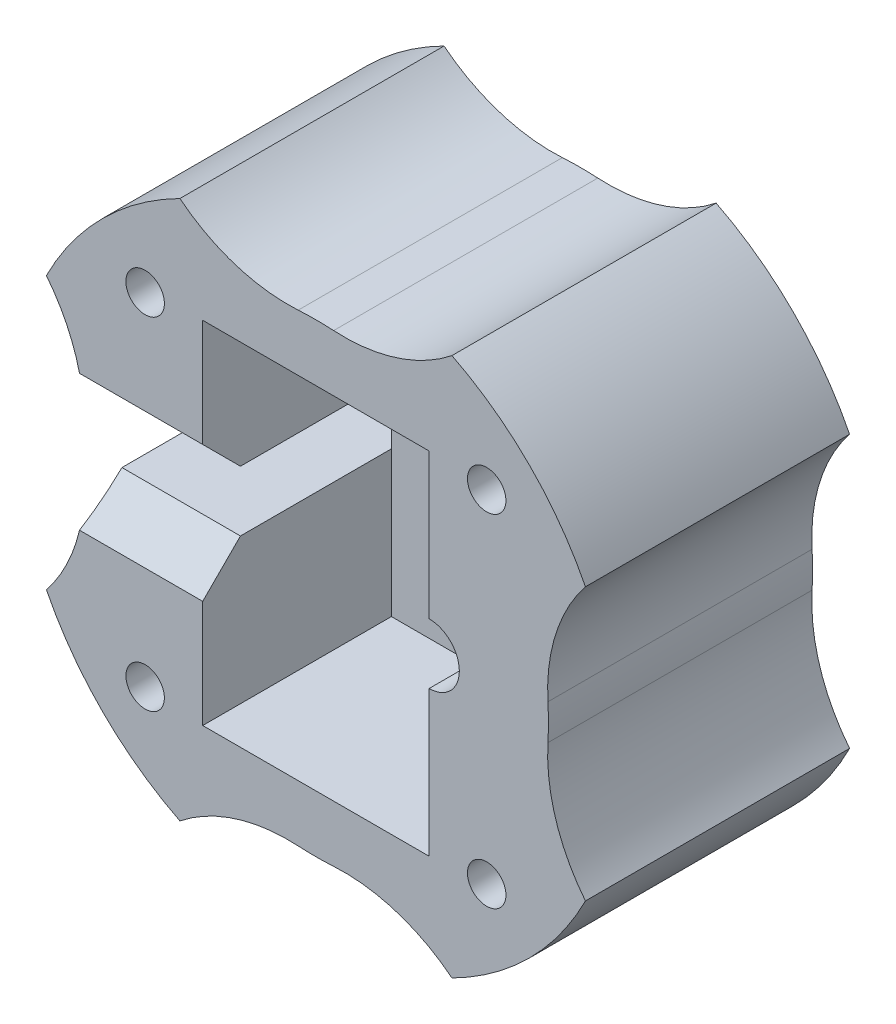
from build123d import *

# Parameters (mm, degrees)
SKETCH1_R           = 40
BOSS_EXTRUDE1_DEPTH = 10
SKETCH3_R           = 40
SKETCH3_W           = 30
SKETCH3_H           = 46.499999994
BOSS_EXTRUDE3_DEPTH = 25
CUT_EXTRUDE1_START  = -35
CUT_EXTRUDE1_DEPTH  = 35
SKETCH5_R           = 2.55
CUT_EXTRUDE2_DEPTH  = 5
CUT_EXTRUDE3_DEPTH  = 25
CUT_EXTRUDE4_DEPTH  = 22
SKETCH9_R           = 1
CUT_EXTRUDE5_DEPTH  = 10
SKETCH10_R          = 1.299999998
SKETCH10_R_2        = 1.299999999
SKETCH10_R_3        = 1.3
CUT_EXTRUDE6_DEPTH  = 10
CHAMFER1_SIZE       = 5


with BuildPart() as part:
    # Sketch1 → Boss-Extrude1 (new body)
    with BuildSketch(Plane.XY):
        with Locations((0, 222.499999997)):
            Circle(SKETCH1_R)
    extrude(amount=BOSS_EXTRUDE1_DEPTH)

    # Sketch3 → Boss-Extrude3 (add)
    with BuildSketch(Plane.XY.offset(10)):
        with Locations((0, 222.499999997)):
            Circle(SKETCH3_R)
        with Locations((0, 222.499999997)):
            Rectangle(SKETCH3_W, SKETCH3_H, mode=Mode.SUBTRACT)
    extrude(amount=BOSS_EXTRUDE3_DEPTH)

    # Sketch4 → Cut-Extrude1 (cut)
    with BuildSketch(Plane.XY.offset(35).offset(CUT_EXTRUDE1_START)):
        with BuildLine():
            ThreePointArc((40, 222.499999997), (38.912456167, 231.763949212), (35.708962247, 240.524150885))
            ThreePointArc((35.708962247, 240.524150885), (31.77566454, 233.14486234), (30.74061322, 224.84706751))
            ThreePointArc((30.74061322, 224.84706751), (30.809531665, 222.499999997), (30.74061322, 220.152932484))
            ThreePointArc((30.74061322, 220.152932484), (31.77566454, 211.855137653), (35.708962247, 204.475849108))
            ThreePointArc((35.708962247, 204.475849108), (38.912456167, 213.236050782), (40, 222.499999997))
        make_face()
        with BuildLine():
            ThreePointArc((-2.347067513, 191.759386777), (-10.644862344, 190.724335457), (-18.024150889, 186.79103775))
            ThreePointArc((-18.024150889, 186.79103775), (0, 182.499999997), (18.024150889, 186.79103775))
            ThreePointArc((18.024150889, 186.79103775), (10.644862344, 190.724335457), (2.347067513, 191.759386777))
            ThreePointArc((2.347067513, 191.759386777), (0, 191.690468331), (-2.347067513, 191.759386777))
        make_face()
        with BuildLine():
            ThreePointArc((18.024150889, 258.208962244), (0, 262.499999997), (-18.024150889, 258.208962244))
            ThreePointArc((-18.024150889, 258.208962244), (-10.644862344, 254.275664537), (-2.347067513, 253.240613217))
            ThreePointArc((-2.347067513, 253.240613217), (0, 253.309531662), (2.347067513, 253.240613217))
            ThreePointArc((2.347067513, 253.240613217), (10.644862344, 254.275664537), (18.024150889, 258.208962244))
        make_face()
        with BuildLine():
            ThreePointArc((-30.74061322, 220.152932484), (-30.809531665, 222.499999997), (-30.74061322, 224.84706751))
            ThreePointArc((-30.74061322, 224.84706751), (-31.77566454, 233.14486234), (-35.708962247, 240.524150885))
            ThreePointArc((-35.708962247, 240.524150885), (-40, 222.499999997), (-35.708962247, 204.475849108))
            ThreePointArc((-35.708962247, 204.475849108), (-31.77566454, 211.855137653), (-30.74061322, 220.152932484))
        make_face()
    extrude(amount=CUT_EXTRUDE1_DEPTH, mode=Mode.SUBTRACT)

    # Sketch5 → Cut-Extrude2 (cut)
    with BuildSketch(Plane.XY.offset(35)):
        with Locations((-22.627416998, 245.127416995)):
            Circle(SKETCH5_R)
        with Locations(Location((22.627416998, 245.127416995, 0), (0, 0, 180))):
            Circle(SKETCH5_R)
        with Locations((22.627416998, 199.872582999)):
            Circle(SKETCH5_R)
        with Locations(Location((-22.627416998, 199.872582999, 0), (0, 0, 180))):
            Circle(SKETCH5_R)
    extrude(amount=-CUT_EXTRUDE2_DEPTH, mode=Mode.SUBTRACT)

    # Sketch6 → Cut-Extrude3 (cut)
    with BuildSketch(Plane.XY.offset(35)):
        with BuildLine():
            Line((-15, 218.499999997), (-15, 226.499999997))
            ThreePointArc((-15, 226.499999997), (-19, 222.499999997), (-15, 218.499999997))
        make_face()
        with BuildLine():
            Line((15, 218.499999997), (15, 226.499999997))
            ThreePointArc((15, 226.499999997), (19, 222.499999997), (15, 218.499999997))
        make_face()
    extrude(amount=-CUT_EXTRUDE3_DEPTH, mode=Mode.SUBTRACT)

    # Sketch8 → Cut-Extrude4 (cut)
    with BuildSketch(Plane(origin=(-15, 0, 0), x_dir=(0, 0, -1), z_dir=(1, 0, 0))):
        Polygon((-22, 226.499999997), (-35, 226.499999997), (-35, 218.499999997), (-22, 218.499999997), (0, 218.499999997), (0, 226.499999997), align=None)
    extrude(amount=-CUT_EXTRUDE4_DEPTH, mode=Mode.SUBTRACT)

    # Sketch9 → Cut-Extrude5 (cut)
    with BuildSketch(Plane(origin=(0, 0, 0), x_dir=(-1, 0, 0), z_dir=(0, 0, -1))):
        with Locations((0, 222.499999997)):
            Circle(SKETCH9_R)
    extrude(amount=-CUT_EXTRUDE5_DEPTH, mode=Mode.SUBTRACT)

    # Sketch10 → Cut-Extrude6 (cut)
    with BuildSketch(Plane(origin=(0, 0, 0), x_dir=(-1, 0, 0), z_dir=(0, 0, -1))):
        with Locations((-6, 234.5)):
            Circle(SKETCH10_R)
        with Locations((6, 234.5)):
            Circle(SKETCH10_R_2)
        with Locations((6, 210.499999997)):
            Circle(SKETCH10_R_3)
        with Locations((-6, 210.499999997)):
            Circle(SKETCH10_R_3)
    extrude(amount=-CUT_EXTRUDE6_DEPTH, mode=Mode.SUBTRACT)

    # Chamfer1
    chamfer1_edges = [part.edges().sort_by_distance(p)[0] for p in [
        (-22.851493975, 218.499999997, 35),
        (-22.851493975, 226.499999997, 35),
    ]]
    chamfer(chamfer1_edges, length=CHAMFER1_SIZE)


solid = part.part
